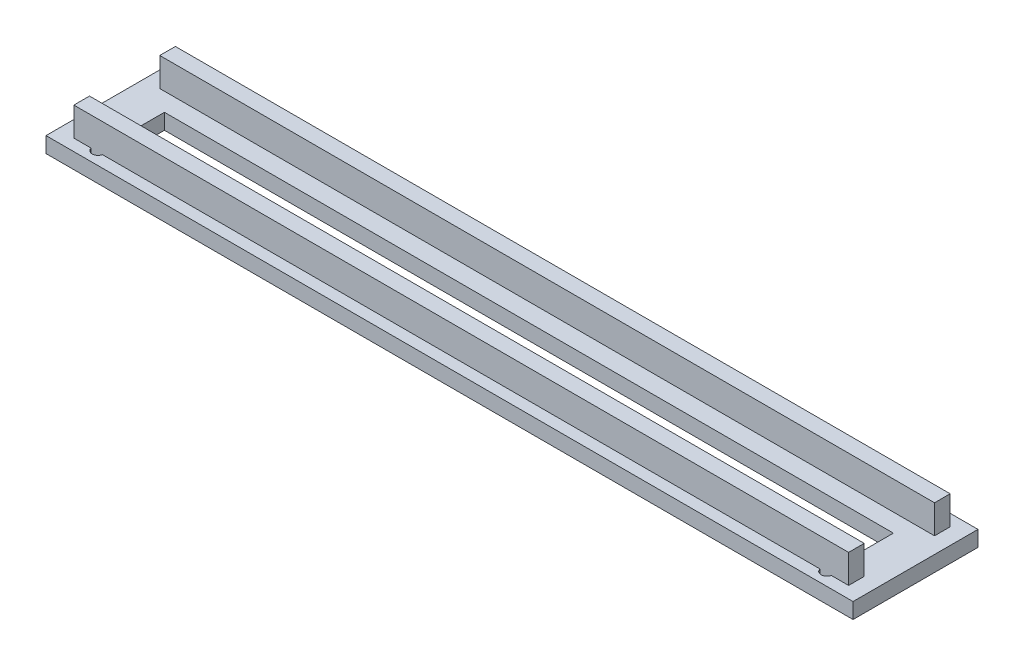
from build123d import *

# Parameters (mm, degrees)
F_01_RAIL_BASE_PROFILE_W   = 620
F_01_RAIL_BASE_PROFILE_H   = 96
F_01_RAIL_BASE_PROFILE_R   = 4.5
F_01_RAIL_BASE_PROFILE_W_2 = 560
F_01_RAIL_BASE_PROFILE_H_2 = 26
F_01_RAIL_BASE_DEPTH       = 12
F_02_GUIDE_RAIL_PROFILES_W = 595.2
F_02_GUIDE_RAIL_PROFILES_H = 12
F_02_GUIDE_RAILS_DEPTH     = 34


with BuildPart() as part:
    # 01_Rail_Base_Profile → 01_Rail_Base (new body)
    with BuildSketch(Plane(origin=(0, 0, 0), x_dir=(1, 0, 0), z_dir=(0, 1, 0))):
        Rectangle(F_01_RAIL_BASE_PROFILE_W, F_01_RAIL_BASE_PROFILE_H)
        with Locations(Location((-280, -38, 0), (0, 0, 270))):
            Circle(F_01_RAIL_BASE_PROFILE_R, mode=Mode.SUBTRACT)
        with Locations(Location((-280, 38, 0), (0, 0, 270))):
            Circle(F_01_RAIL_BASE_PROFILE_R, mode=Mode.SUBTRACT)
        with Locations(Location((280, -38, 0), (0, 0, 270))):
            Circle(F_01_RAIL_BASE_PROFILE_R, mode=Mode.SUBTRACT)
        with Locations(Location((280, 38, 0), (0, 0, 270))):
            Circle(F_01_RAIL_BASE_PROFILE_R, mode=Mode.SUBTRACT)
        Rectangle(F_01_RAIL_BASE_PROFILE_W_2, F_01_RAIL_BASE_PROFILE_H_2, mode=Mode.SUBTRACT)
    extrude(amount=F_01_RAIL_BASE_DEPTH)

    # 02_Guide_Rail_Profiles → 02_Guide_Rails (add)
    with BuildSketch(Plane(origin=(0, 0, 0), x_dir=(1, 0, 0), z_dir=(0, 1, 0))):
        with Locations((0, 33)):
            Rectangle(F_02_GUIDE_RAIL_PROFILES_W, F_02_GUIDE_RAIL_PROFILES_H)
        with Locations((0, -33)):
            Rectangle(F_02_GUIDE_RAIL_PROFILES_W, F_02_GUIDE_RAIL_PROFILES_H)
    extrude(amount=F_02_GUIDE_RAILS_DEPTH)


solid = part.part
